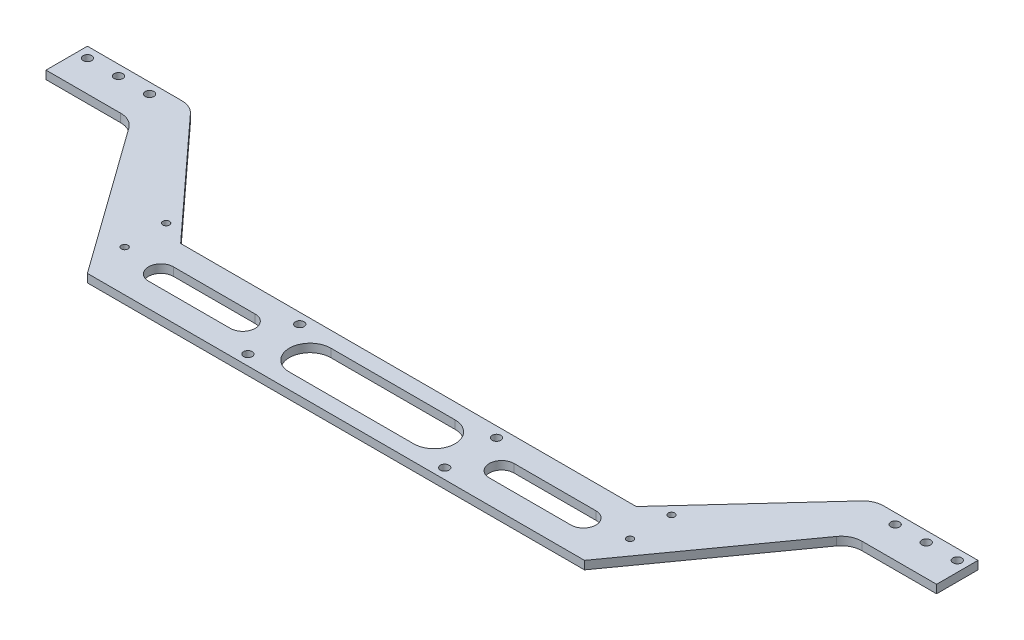
from build123d import *

# Parameters (mm, degrees)
SKETCH_2_R          = 2.1
EXTRUDE_1_DEPTH     = 4
SKETCH_3_R          = 1.6
CUT_EXTRUDE_1_DEPTH = 10
FILLET_1_R          = 10
CUT_EXTRUDE_2_DEPTH = 278.528827332


with BuildPart() as part:
    # 草图2 → 凸台-拉伸1 (new body)
    with BuildSketch(Plane(origin=(0, 0, 0), x_dir=(1, 0, 0), z_dir=(0, 1, 0))):
        Polygon((-72.5, -5), (167.5, -5), (221.298034327, 70), (262.5, 70), (262.5, 90), (212.5, 90), (157.5, 30), (-62.5, 30), (-117.5, 90), (-167.5, 90), (-167.5, 70), (-126.298034327, 70), align=None)
        with Locations(Location((0, 0, 0), (0, 0, 270))):
            Circle(SKETCH_2_R, mode=Mode.SUBTRACT)
        with Locations(Location((95, 0, 0), (0, 0, 270))):
            Circle(SKETCH_2_R, mode=Mode.SUBTRACT)
        with Locations(Location((95, 25, 0), (0, 0, 270))):
            Circle(SKETCH_2_R, mode=Mode.SUBTRACT)
        with Locations(Location((0, 25, 0), (0, 0, 270))):
            Circle(SKETCH_2_R, mode=Mode.SUBTRACT)
        with Locations(Location((-162.5, 85, 0), (0, 0, 270))):
            Circle(SKETCH_2_R, mode=Mode.SUBTRACT)
        with Locations(Location((-147.5, 85, 0), (0, 0, 270))):
            Circle(SKETCH_2_R, mode=Mode.SUBTRACT)
        with Locations(Location((-132.5, 85, 0), (0, 0, 270))):
            Circle(SKETCH_2_R, mode=Mode.SUBTRACT)
        with Locations(Location((227.5, 85, 0), (0, 0, 90))):
            Circle(SKETCH_2_R, mode=Mode.SUBTRACT)
        with Locations(Location((242.5, 85, 0), (0, 0, 90))):
            Circle(SKETCH_2_R, mode=Mode.SUBTRACT)
        with Locations(Location((257.5, 85, 0), (0, 0, 90))):
            Circle(SKETCH_2_R, mode=Mode.SUBTRACT)
        with BuildLine():
            Line((77.5, 2.5), (17.5, 2.5))
            ThreePointArc((17.5, 2.5), (7.5, 12.5), (17.5, 22.5))
            Line((17.5, 22.5), (77.5, 22.5))
            ThreePointArc((77.5, 22.5), (87.5, 12.5), (77.5, 2.5))
        make_face(mode=Mode.SUBTRACT)
    extrude(amount=EXTRUDE_1_DEPTH)

    # 草图3 → 切除-拉伸1 (cut)
    with BuildSketch(Plane.XZ):
        with Locations(Location((169.5, -35, 0), (0, 0, 270))):
            Circle(SKETCH_3_R)
        with Locations(Location((169.5, -15, 0), (0, 0, 270))):
            Circle(SKETCH_3_R)
        with Locations(Location((-74.5, -15, 0), (0, 0, 270))):
            Circle(SKETCH_3_R)
        with Locations(Location((-74.5, -35, 0), (0, 0, 270))):
            Circle(SKETCH_3_R)
    extrude(amount=-CUT_EXTRUDE_1_DEPTH, mode=Mode.SUBTRACT)

    # 圆角1
    fillet_1_edges = [part.edges().sort_by_distance(p)[0] for p in [
        (212.5, 2, -90),
        (221.298034327, 2, -70),
        (-126.298034327, 2, -70),
        (-117.5, 2, -90),
    ]]
    fillet(fillet_1_edges, radius=FILLET_1_R)

    # 草图4 → 切除-拉伸2 (cut, through all)
    with BuildSketch(Plane(origin=(0, 4, 0), x_dir=(1, 0, 0), z_dir=(0, 1, 0))):
        with BuildLine():
            Line((-54.5, 18.5), (-15, 18.5))
            ThreePointArc((-15, 18.5), (-9, 12.5), (-15, 6.5))
            Line((-15, 6.5), (-54.5, 6.5))
            ThreePointArc((-54.5, 6.5), (-60.5, 12.5), (-54.5, 18.5))
        make_face()
        with BuildLine():
            Line((149.5, 18.5), (110, 18.5))
            ThreePointArc((110, 18.5), (104, 12.5), (110, 6.5))
            Line((110, 6.5), (149.5, 6.5))
            ThreePointArc((149.5, 6.5), (155.5, 12.5), (149.5, 18.5))
        make_face()
    extrude(amount=-CUT_EXTRUDE_2_DEPTH, mode=Mode.SUBTRACT)


solid = part.part
